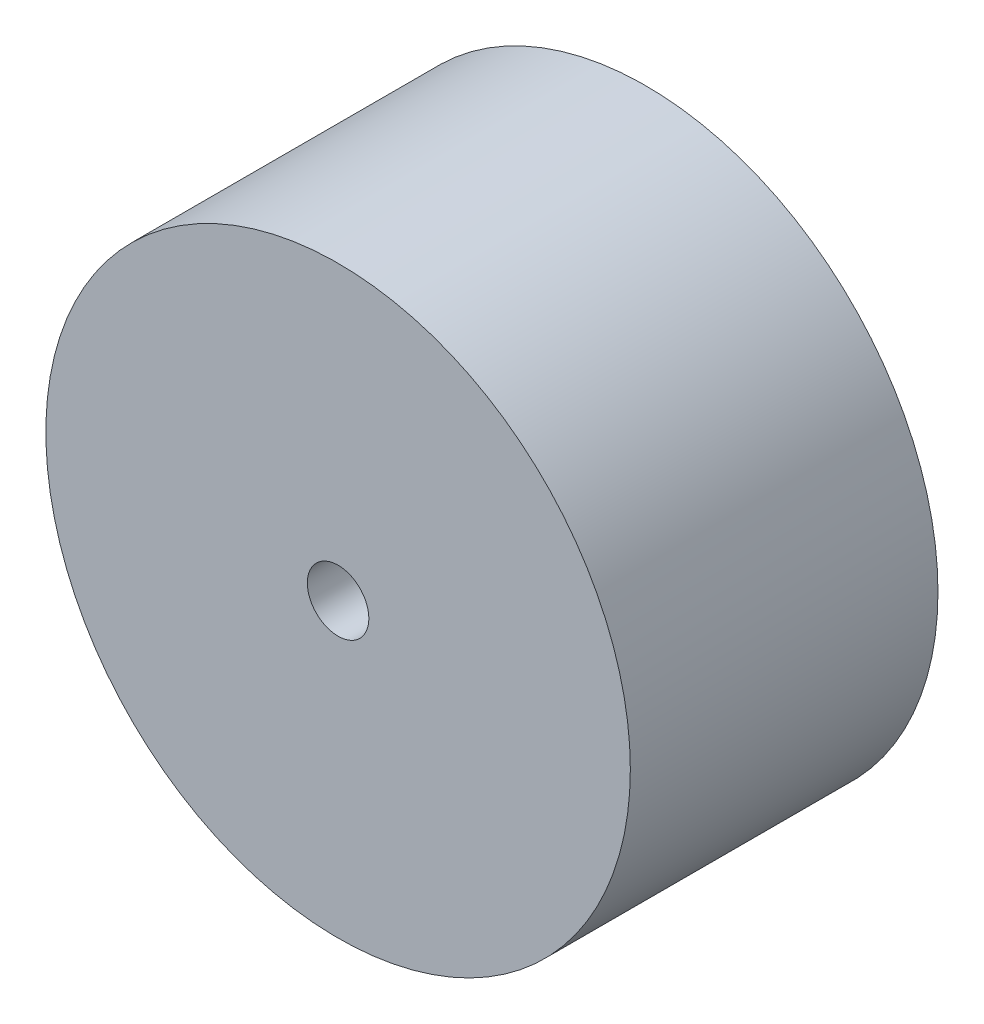
from build123d import *

# Parameters (mm, degrees)
SKETCH_1_R          = 28.5
EXTRUDE_1_DEPTH     = 30
SKETCH_2_R          = 3
CUT_EXTRUDE_1_DEPTH = 40


with BuildPart() as part:
    # ｽｹｯﾁ1 → ﾎﾞｽ - 押し出し1 (new body)
    with BuildSketch(Plane.XY):
        with Locations((-12.69412037, 1.2144375)):
            Circle(SKETCH_1_R)
    extrude(amount=EXTRUDE_1_DEPTH)

    # ｽｹｯﾁ2 → ｶｯﾄ - 押し出し1 (cut)
    with BuildSketch(Plane.XY.offset(30)):
        with Locations((-12.69412037, 1.2144375)):
            Circle(SKETCH_2_R)
    extrude(amount=-CUT_EXTRUDE_1_DEPTH, mode=Mode.SUBTRACT)


solid = part.part
